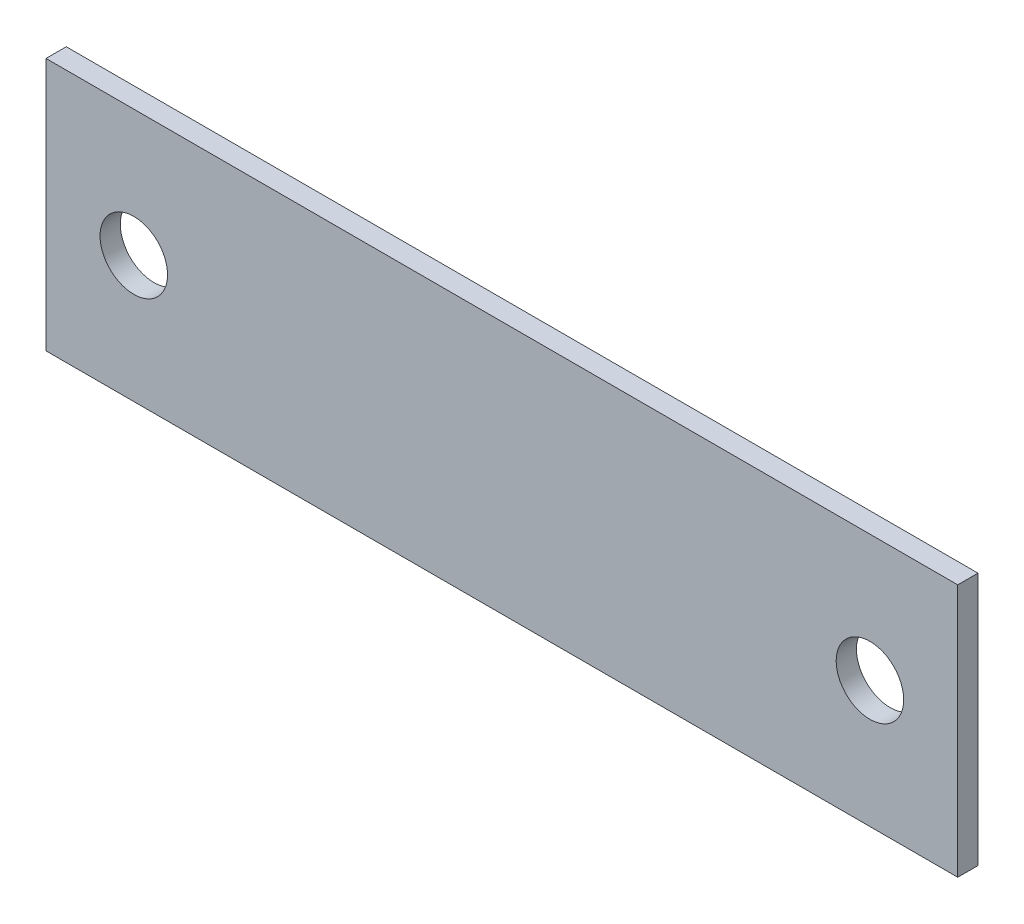
from build123d import *

# Parameters (mm, degrees)
ESBO_O1_W                  = 54
ESBO_O1_H                  = 15
RESSALTO_EXTRUS_O1_DEPTH   = 1.2
CORTE_EXTRUS_O1_DEPTH      = 5
CORTE_EXTRUS_O1_DEPTH_BACK = 1.2
ESBO_O2_R                  = 2


with BuildPart() as part:
    # Esboço1 → Ressalto-extrusão1 (new body)
    with BuildSketch(Plane.XY):
        Rectangle(ESBO_O1_W, ESBO_O1_H)
    extrude(amount=RESSALTO_EXTRUS_O1_DEPTH)

    # Esboço2 → Corte-extrusão1 (cut, two sides: drawn at the far end of the back side and taken through both)
    with BuildSketch(Plane.XY.offset(-CORTE_EXTRUS_O1_DEPTH_BACK)):
        with Locations(Location((-21.8, 0, 0), (0, 0, 180))):
            Circle(ESBO_O2_R)
        with Locations(Location((21.8, 0, 0), (0, 0, 180))):
            Circle(ESBO_O2_R)
    extrude(amount=CORTE_EXTRUS_O1_DEPTH + CORTE_EXTRUS_O1_DEPTH_BACK, mode=Mode.SUBTRACT)


solid = part.part
